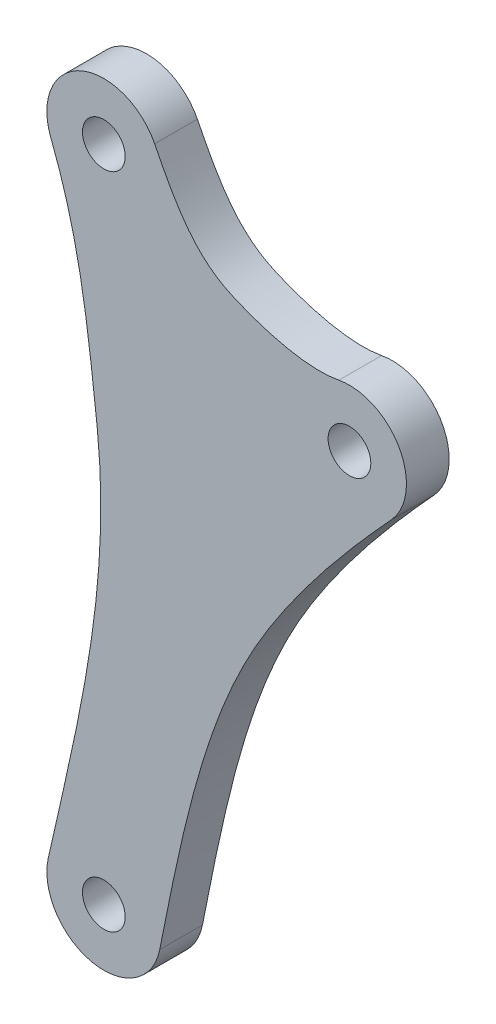
from build123d import *

# Parameters (mm, degrees)
ESQUISSE15_R        = 1.5
BOSS_EXTRU_15_DEPTH = 3


with BuildPart() as part:
    # Esquisse15 → Boss.-Extru.15 (new body)
    with BuildSketch(Plane.XY):
        with BuildLine():
            ThreePointArc((84.615566757, 77.214807715), (79.410356581, 79.056476896), (77.32447165, 73.944232535))
            add(Edge.make_bspline(
                [(77.145713615, 30.055195656), (79.080308516, 38.622687362), (81.66327099, 48.786134392), (79.931018502, 63.688726471), (79.143562251, 69.313820095), (77.32447165, 73.944232535)],
                knots=[0, 0, 0, 0, 0.576573495, 0.676573495, 1, 1, 1, 1], degree=3))
            ThreePointArc((77.145713615, 30.055195656), (80.218465063, 25.261002777), (84.971318589, 28.39731752))
            add(Edge.make_bspline(
                [(101.238857322, 62.671617625), (98.376312092, 59.555241307), (94.899619815, 55.416000824), (88.227335604, 44.717523156), (86.528624586, 36.263368643), (84.971318589, 28.39731752)],
                knots=[0, 0, 0, 0, 0.311641153, 0.411641153, 1, 1, 1, 1], degree=3))
            ThreePointArc((101.238857322, 62.671617625), (101.788339756, 67.322427703), (97.546599361, 69.307271211))
            add(Edge.make_bspline(
                [(84.615566757, 77.214807715), (85.76555462, 74.945262877), (87.284529762, 71.896675961), (92.709580096, 69.538935669), (95.692727353, 68.955151445), (97.546599361, 69.307271211)],
                knots=[0, 0, 0, 0, 0.456100215, 0.556100215, 1, 1, 1, 1], degree=3))
        make_face()
        with Locations((81.047477623, 75.406842025)):
            Circle(ESQUISSE15_R, mode=Mode.SUBTRACT)
        with Locations((98.293004791, 65.377528352)):
            Circle(ESQUISSE15_R, mode=Mode.SUBTRACT)
        with Locations((81.047477623, 29.17415217)):
            Circle(ESQUISSE15_R, mode=Mode.SUBTRACT)
    extrude(amount=BOSS_EXTRU_15_DEPTH)


solid = part.part
